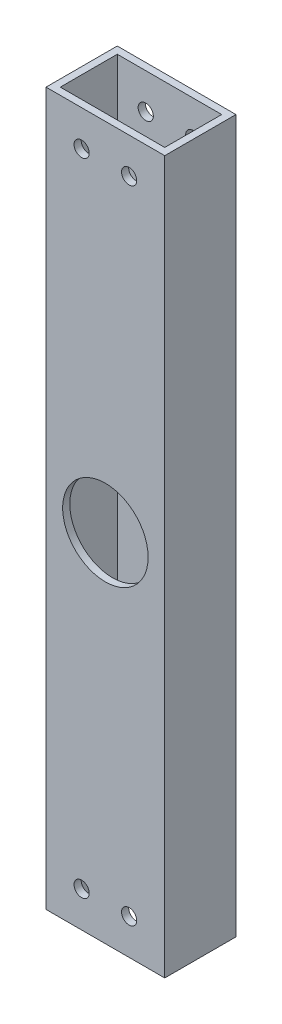
from build123d import *

# Parameters (mm, degrees)
SKETCH_1_W          = 25
SKETCH_1_H          = 15
SKETCH_1_W_2        = 22
SKETCH_1_H_2        = 12
EXTRUDE_1_DEPTH     = 150
SKETCH_2_R          = 1.6
SKETCH_2_R_2        = 9
CUT_EXTRUDE_1_DEPTH = 152.265495074


with BuildPart() as part:
    # ｽｹｯﾁ1 → ﾎﾞｽ - 押し出し1 (new body)
    with BuildSketch(Plane(origin=(0, 0, 0), x_dir=(1, 0, 0), z_dir=(0, 1, 0))):
        Rectangle(SKETCH_1_W, SKETCH_1_H)
        Rectangle(SKETCH_1_W_2, SKETCH_1_H_2, mode=Mode.SUBTRACT)
    extrude(amount=EXTRUDE_1_DEPTH)

    # ｽｹｯﾁ2 → ｶｯﾄ - 押し出し1 (cut, through all)
    with BuildSketch(Plane.XY.offset(7.5)):
        with Locations((5, 7.5)):
            Circle(SKETCH_2_R)
        with Locations((-5, 7.5)):
            Circle(SKETCH_2_R)
        with Locations(Location((5, 142.5, 0), (0, 0, 180))):
            Circle(SKETCH_2_R)
        with Locations(Location((-5, 142.5, 0), (0, 0, 180))):
            Circle(SKETCH_2_R)
        with Locations((0, 75)):
            Circle(SKETCH_2_R_2)
    extrude(amount=-CUT_EXTRUDE_1_DEPTH, mode=Mode.SUBTRACT)


solid = part.part
